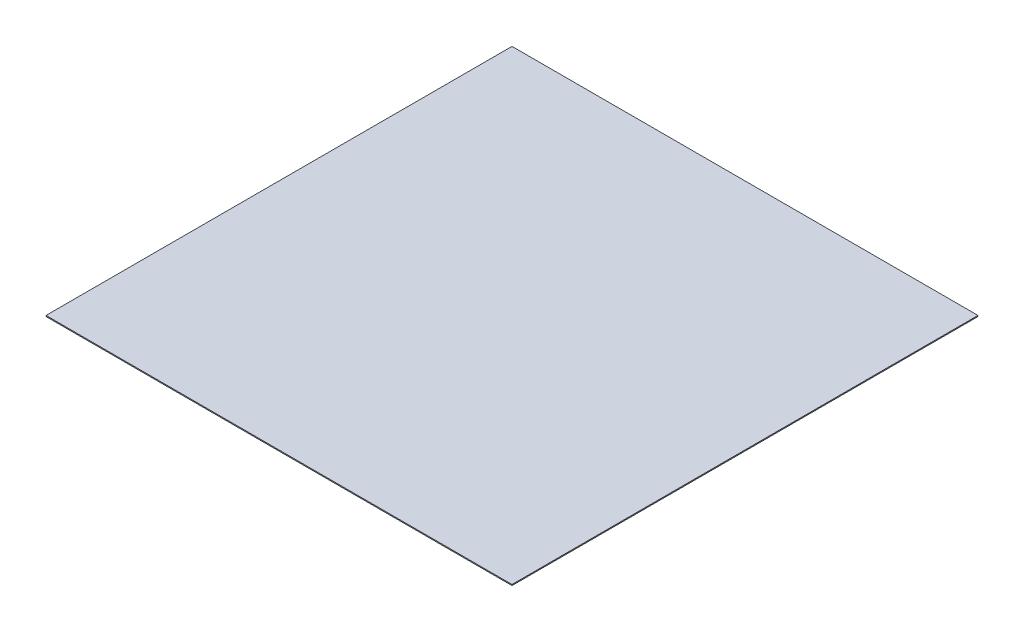
from build123d import *

# Parameters (mm, degrees)
SKETCH1_W           = 139.7
SKETCH1_H           = 139.7
BOSS_EXTRUDE1_DEPTH = 0.15


with BuildPart() as part:
    # Sketch1 → Boss-Extrude1 (new, symmetric)
    with BuildSketch(Plane(origin=(0, 0, 0), x_dir=(1, 0, 0), z_dir=(0, 1, 0))):
        Rectangle(SKETCH1_W, SKETCH1_H)
    extrude(amount=BOSS_EXTRUDE1_DEPTH, both=True)


solid = part.part
